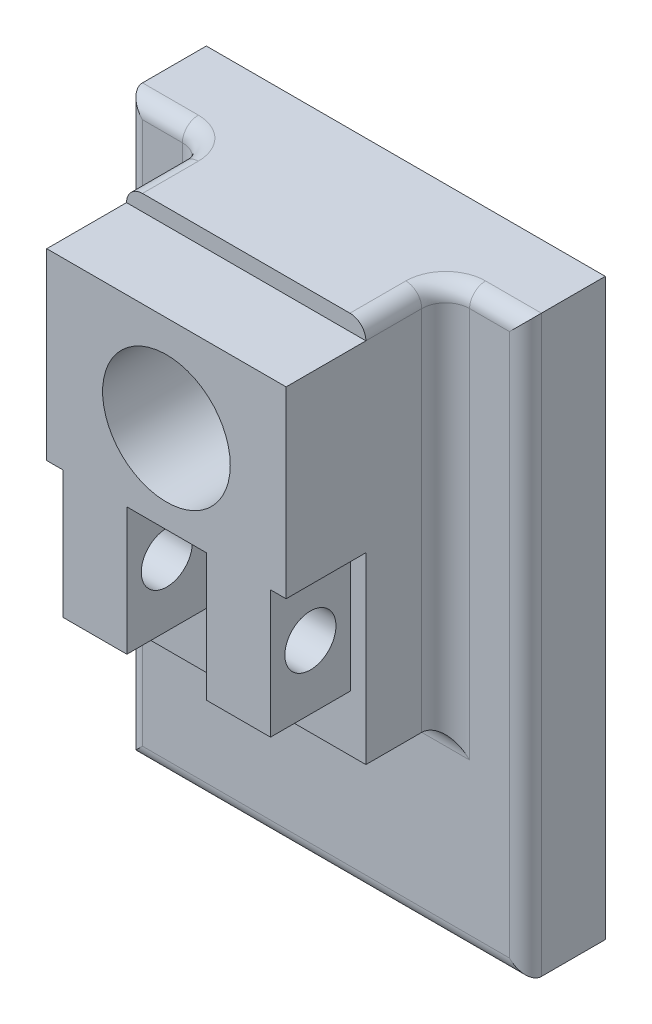
from build123d import *

# Parameters (mm, degrees)
SKETCH1_W           = 125
SKETCH1_H           = 180
BASE_EXTRUDE_DEPTH  = 25
SKETCH2_W           = 75
SKETCH2_H           = 120
BOSS_EXTRUDE1_DEPTH = 25
FILLET2_R           = 7.5
FILLET4_R           = 5
SKETCH4_W           = 75
SKETCH4_H           = 57.5
BOSS_EXTRUDE2_DEPTH = 25
SKETCH7_R           = 20
CUT_EXTRUDE2_DEPTH  = 105
SKETCH8_W           = 20
SKETCH8_H           = 40
BOSS_EXTRUDE4_DEPTH = 25
SKETCH9_R           = 8
CUT_EXTRUDE3_DEPTH  = 89
SKETCH10_W          = 25
SKETCH10_H          = 57.5
CUT_EXTRUDE4_DEPTH  = 31
SKETCH12_W          = 25
SKETCH12_H          = 43.423813554
CUT_EXTRUDE6_DEPTH  = 7


with BuildPart() as part:
    # Sketch1 → Base-Extrude (new body)
    with BuildSketch(Plane.XY):
        with Locations((-7.794747082, 12.712840467)):
            Rectangle(SKETCH1_W, SKETCH1_H)
    extrude(amount=BASE_EXTRUDE_DEPTH)

    # Sketch2 → Boss-Extrude1 (add)
    with BuildSketch(Plane.XY.offset(25)):
        with Locations((-7.794747082, 42.712840467)):
            Rectangle(SKETCH2_W, SKETCH2_H)
    extrude(amount=BOSS_EXTRUDE1_DEPTH)

    # Fillet2
    fillet2_edges = [part.edges().sort_by_distance(p)[0] for p in [
        (-45.294747082, 42.712840467, 25),
        (-7.794747082, -17.287159533, 25),
        (29.705252918, 42.712840467, 25),
    ]]
    fillet(fillet2_edges, radius=FILLET2_R)

    # Fillet4
    fillet4_edges = [part.edges().sort_by_distance(p)[0] for p in [
        (54.705252918, 12.712840467, 25),
        (-61.544747082, 102.712840467, 25),
        (-45.294747082, 102.712840467, 41.25),
        (29.705252918, 102.712840467, 41.25),
        (31.901952059, 102.712840467, 27.196699141),
        (-47.491446223, 102.712840467, 27.196699141),
        (-70.294747082, 12.712840467, 25),
        (-7.794747082, -77.287159533, 25),
    ]]
    fillet(fillet4_edges, radius=FILLET4_R)

    # Sketch4 → Boss-Extrude2 (add)
    with BuildSketch(Plane.XY.offset(50)):
        with Locations((-7.794747082, 68.962840467)):
            Rectangle(SKETCH4_W, SKETCH4_H)
    extrude(amount=BOSS_EXTRUDE2_DEPTH)

    # Sketch7 → Cut-Extrude2 (cut)
    with BuildSketch(Plane.XY.offset(75)):
        with Locations((-7.794747082, 67.712840467)):
            Circle(SKETCH7_R)
    extrude(amount=-CUT_EXTRUDE2_DEPTH, mode=Mode.SUBTRACT)

    # Sketch8 → Boss-Extrude4 (add)
    with BuildSketch(Plane.XY.offset(50)):
        with Locations((-30.180989309, 20.212840467)):
            Rectangle(SKETCH8_W, SKETCH8_H)
        with Locations((14.819010691, 20.212840467)):
            Rectangle(SKETCH8_W, SKETCH8_H)
    extrude(amount=BOSS_EXTRUDE4_DEPTH)

    # Sketch9 → Cut-Extrude3 (cut)
    with BuildSketch(Plane(origin=(24.819010691, 0, 0), x_dir=(0, 0, -1), z_dir=(1, 0, 0))):
        with Locations(Location((-62.5, 20.212840467, 0), (0, 0, 90))):
            Circle(SKETCH9_R)
    extrude(amount=-CUT_EXTRUDE3_DEPTH, mode=Mode.SUBTRACT)

    # Sketch10 → Cut-Extrude4 (cut)
    with BuildSketch(Plane.XY.offset(50)):
        with Locations((-7.680989309, 11.462840467)):
            Rectangle(SKETCH10_W, SKETCH10_H)
    extrude(amount=-CUT_EXTRUDE4_DEPTH, mode=Mode.SUBTRACT)

    # Sketch12 → Cut-Extrude6 (cut)
    with BuildSketch(Plane.XZ.offset(-40.212840467)):
        with Locations((-7.680989309, 40.711906777)):
            Rectangle(SKETCH12_W, SKETCH12_H)
    extrude(amount=-CUT_EXTRUDE6_DEPTH, mode=Mode.SUBTRACT)


solid = part.part
